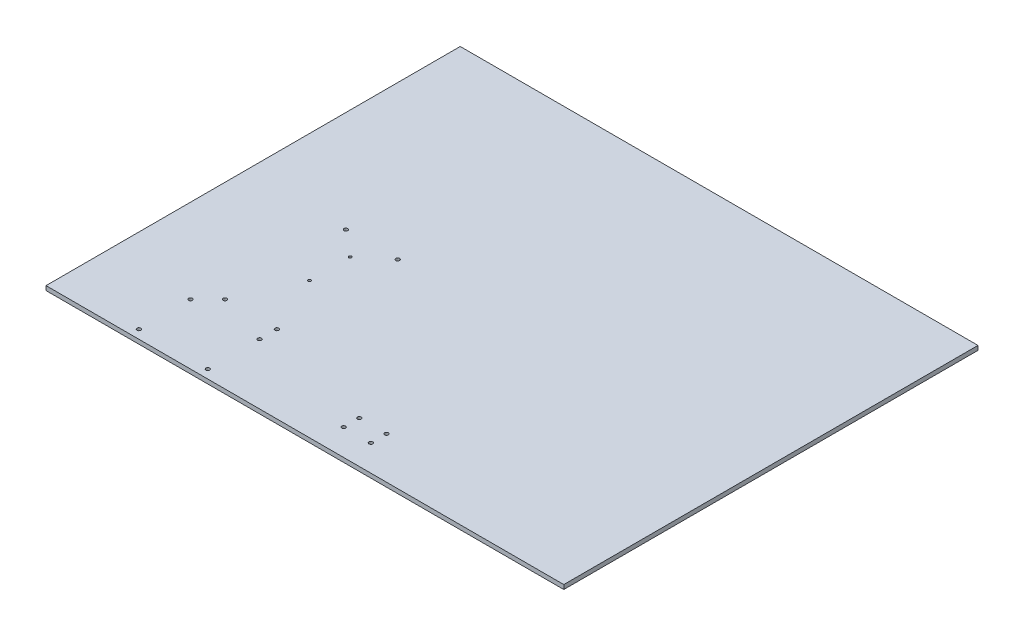
from build123d import *

# Parameters (mm, degrees)
SKETCH1_W             = 762
SKETCH1_H             = 609.6
BOSS_EXTRUDE1_DEPTH   = 6.35
M5_CLEARANCE_HOLE1_D  = 5.5
M5_CLEARANCE_HOLE2_D  = 5.5
M5X0_8_TAPPED_HOLE2_D = 4.2


with BuildPart() as part:
    # Sketch1 → Boss-Extrude1 (new body)
    with BuildSketch(Plane(origin=(0, 0, 0), x_dir=(1, 0, 0), z_dir=(0, 1, 0))):
        with Locations((381, 304.8)):
            Rectangle(SKETCH1_W, SKETCH1_H)
    extrude(amount=BOSS_EXTRUDE1_DEPTH)

    # M5 Clearance Hole1 (through all)
    with Locations(Plane(origin=(0, 6.35, 0), x_dir=(1, 0, 0), z_dir=(0, 1, 0))):
        with Locations((439.4454, 61.6712), (399.4404, 61.6712), (399.4404, 38.6588), (439.4454, 38.6588)):
            Hole(M5_CLEARANCE_HOLE1_D / 2)

    # M5 Clearance Hole2 (through all)
    with Locations(Plane(origin=(0, 6.35, 0), x_dir=(1, 0, 0), z_dir=(0, 1, 0))):
        with Locations((123.8758, 12.7), (225.4758, 12.7), (225.4758, 88.9), (123.8758, 88.9), (225.4758, 114.3), (225.4758, 292.1), (149.2758, 292.1), (149.2758, 114.3)):
            Hole(M5_CLEARANCE_HOLE2_D / 2)

    # M5x0.8 Tapped Hole2 (through all)
    with Locations(Plane(origin=(0, 6.35, 0), x_dir=(1, 0, 0), z_dir=(0, 1, 0))):
        with Locations((187.3758, 260.35), (187.3758, 200.3552)):
            Hole(M5X0_8_TAPPED_HOLE2_D / 2)


solid = part.part
